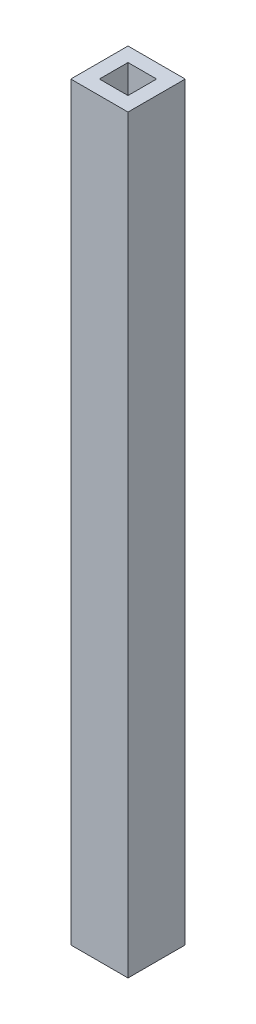
from build123d import *

# Parameters (mm, degrees)
SKETCH3_W           = 25.4
SKETCH3_H           = 25.4
SKETCH3_W_2         = 12.7
SKETCH3_H_2         = 12.7
BOSS_EXTRUDE2_DEPTH = 333


with BuildPart() as part:
    # Sketch3 → Boss-Extrude2 (new body)
    with BuildSketch(Plane(origin=(0, 0, 0), x_dir=(1, 0, 0), z_dir=(0, 1, 0))):
        with Locations((12.7, 12.7)):
            Rectangle(SKETCH3_W, SKETCH3_H)
        with Locations((12.7, 12.7)):
            Rectangle(SKETCH3_W_2, SKETCH3_H_2, mode=Mode.SUBTRACT)
    extrude(amount=BOSS_EXTRUDE2_DEPTH)


solid = part.part
